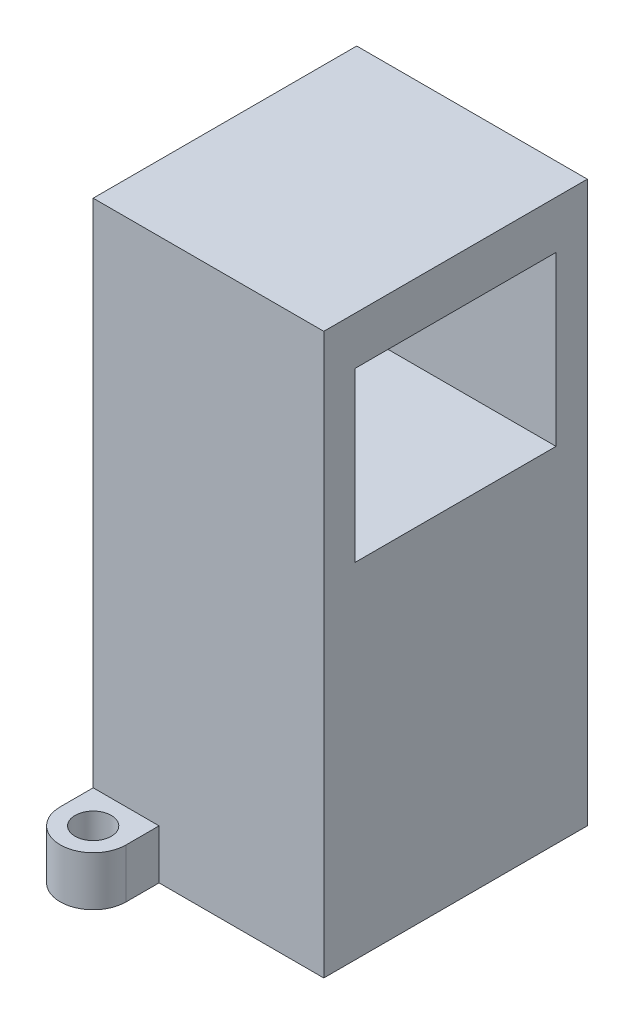
from build123d import *

# Parameters (mm, degrees)
SKETCH_1_W               = 14
SKETCH_1_H               = 16
EXTRUDE_1_DEPTH          = 34
CUT_EXTRUDE_1_DEPTH      = 36.623026261
CUT_EXTRUDE_1_DEPTH_BACK = 36.623026261
SKETCH_2_W               = 12.2
SKETCH_2_H               = 10.2
SKETCH_3_R               = 1.1
EXTRUDE_2_DEPTH          = 3


with BuildPart() as part:
    # 草图1 → 凸台-拉伸1 (new body)
    with BuildSketch(Plane(origin=(0, 0, 0), x_dir=(1, 0, 0), z_dir=(0, 1, 0))):
        Rectangle(SKETCH_1_W, SKETCH_1_H)
    extrude(amount=EXTRUDE_1_DEPTH)

    # 草图2 → 切除-拉伸1 (cut, two sides: drawn at the far end of the back side and taken through both)
    with BuildSketch(Plane(origin=(0, 0, 0), x_dir=(0, 0, -1), z_dir=(1, 0, 0)).offset(-CUT_EXTRUDE_1_DEPTH_BACK)):
        with Locations((0, 26)):
            Rectangle(SKETCH_2_W, SKETCH_2_H)
    extrude(amount=CUT_EXTRUDE_1_DEPTH + CUT_EXTRUDE_1_DEPTH_BACK, mode=Mode.SUBTRACT)

    # 草图3 → 凸台-拉伸2 (add)
    with BuildSketch(Plane(origin=(0, 0, 0), x_dir=(1, 0, 0), z_dir=(0, 1, 0))):
        with BuildLine():
            Line((-7, 8), (-7, 10))
            ThreePointArc((-7, 10), (-5, 12), (-3, 10))
            Line((-3, 10), (-3, 8))
            Line((-3, 8), (-7, 8))
        make_face()
        with Locations(Location((-5, 10, 0), (0, 0, 270))):
            Circle(SKETCH_3_R, mode=Mode.SUBTRACT)
    extrude_2 = extrude(amount=EXTRUDE_2_DEPTH)

    # 镜向1: 凸台-拉伸2 across plane
    add(extrude_2.mirror(Plane.XY))


solid = part.part
